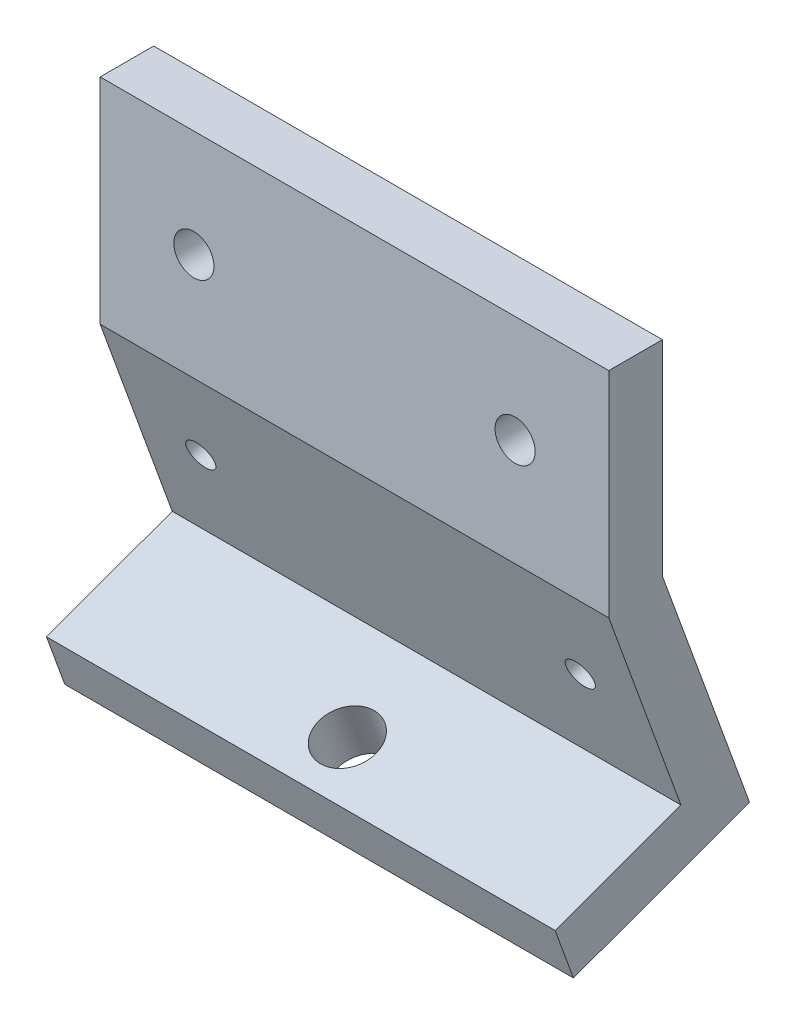
from build123d import *

# Parameters (mm, degrees)
BOSS_EXTRUDE1_DEPTH            = 30.1625
F_1_4_CLEARANCE_HOLE1_D        = 6.7564
M3_CLEARANCE_HOLE1_D           = 3.4
F_3_16_0_1875_DIAMETER_HOLE2_D = 4.7625


with BuildPart() as part:
    # Sketch2 → Boss-Extrude1 (new, symmetric)
    with BuildSketch(Plane(origin=(0, 0, 0), x_dir=(0, 0, -1), z_dir=(1, 0, 0))):
        Polygon((0, 0), (0, 25.4), (6.35, 25.4), (6.35, 1.119676327), (16.689379635, -27.287535752), (-4.195288862, -34.888933437), (-6.367116772, -28.921885295), (8.550503583, -23.49231552), align=None)
    extrude(amount=BOSS_EXTRUDE1_DEPTH, both=True)

    # 1/4 Clearance Hole1 (through all)
    with Locations(Plane(origin=(0, -23.49231552, -8.550503583), x_dir=(1, 0, 0), z_dir=(0, 0.9396926207859081, 0.3420201433256697))):
        with Locations((0, -10)):
            Hole(F_1_4_CLEARANCE_HOLE1_D / 2)

    # M3 Clearance Hole1 (through all)
    with Locations(Plane(origin=(0, 0, 0), x_dir=(1, 0, 0), z_dir=(0, -0.3420201433256693, 0.9396926207859083))):
        with Locations((-22.5, -12.5), (22.5, -12.5)):
            Hole(M3_CLEARANCE_HOLE1_D / 2)

    # 3/16 (0.1875) Diameter Hole2 (through all)
    with Locations(Plane.XY):
        with Locations((-19.05, 12.7), (19.05, 12.7)):
            Hole(F_3_16_0_1875_DIAMETER_HOLE2_D / 2)


solid = part.part
